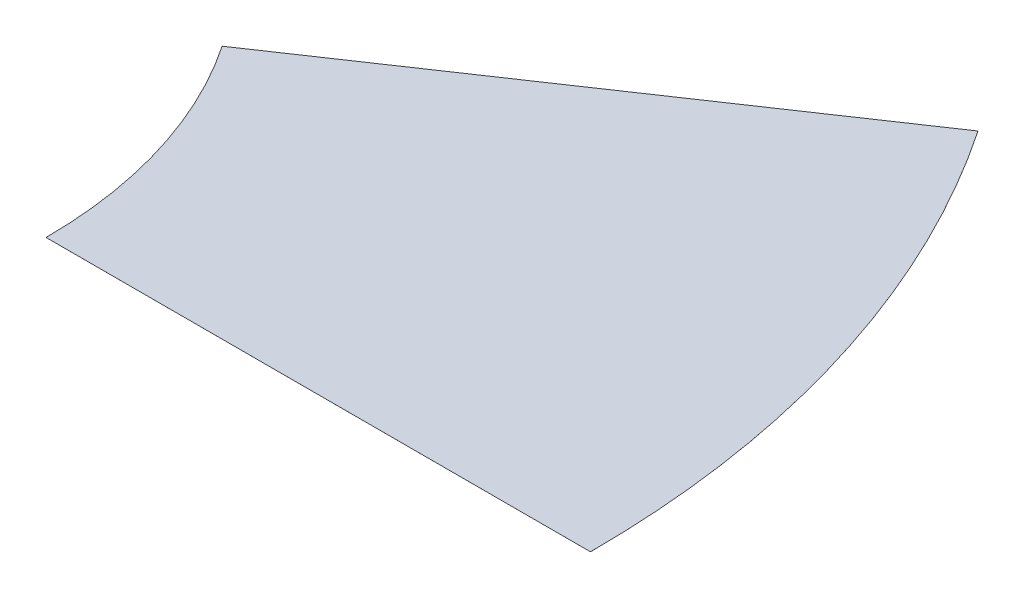
from build123d import *

# Parameters (mm, degrees)
EXTRUDE_1_DEPTH = 0.001


with BuildPart() as part:
    # 草图1 → 凸台-拉伸1 (new body)
    with BuildSketch(Plane(origin=(0, 0, 0), x_dir=(1, 0, 0), z_dir=(0, 1, 0))):
        with BuildLine():
            Line((91.194132981, 61.511219382), (41.451878628, 27.959645174))
            ThreePointArc((41.451878628, 27.959645174), (47.815237798, 14.618585236), (50, 0))
            Line((50, 0), (110, 0))
            ThreePointArc((110, 0), (105.193523156, 32.16088752), (91.194132981, 61.511219382))
        make_face()
    extrude(amount=EXTRUDE_1_DEPTH)


solid = part.part
